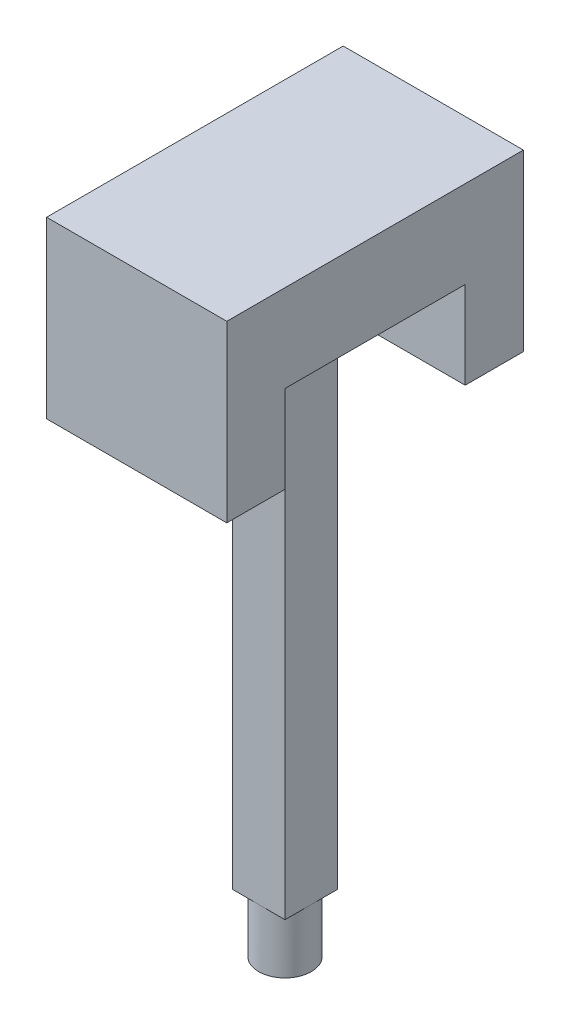
from build123d import *

# Parameters (mm, degrees)
SKETCH1_W           = 1.506666666
SKETCH1_H           = 1.506666666
BOSS_EXTRUDE1_DEPTH = 15
SKETCH2_R           = 0.753333333
BOSS_EXTRUDE2_DEPTH = 1.666666667
SKETCH3_W           = 5.16
SKETCH3_H           = 8.493333334
BOSS_EXTRUDE3_DEPTH = 2.5
SKETCH3_3_W         = 5.16
SKETCH3_3_H         = 1.666666667
BOSS_EXTRUDE4_DEPTH = 2.5


with BuildPart() as part:
    # Sketch1 → Boss-Extrude1 (new body)
    with BuildSketch(Plane(origin=(0, 0, 0), x_dir=(1, 0, 0), z_dir=(0, 1, 0))):
        Rectangle(SKETCH1_W, SKETCH1_H)
    extrude(amount=BOSS_EXTRUDE1_DEPTH)

    # Sketch2 → Boss-Extrude2 (add)
    with BuildSketch(Plane.XZ):
        Circle(SKETCH2_R)
    extrude(amount=BOSS_EXTRUDE2_DEPTH)

    # Sketch3 → Boss-Extrude3 (add)
    with BuildSketch(Plane(origin=(0, 15, 0), x_dir=(1, 0, 0), z_dir=(0, 1, 0))):
        Rectangle(SKETCH3_W, SKETCH3_H)
    extrude(amount=BOSS_EXTRUDE3_DEPTH)

    # Sketch3<3> → Boss-Extrude4 (add)
    with BuildSketch(Plane(origin=(0, 15, 0), x_dir=(1, 0, 0), z_dir=(0, 1, 0))):
        with Locations((0, 3.413333334)):
            Rectangle(SKETCH3_3_W, SKETCH3_3_H)
        with Locations((0, -3.413333334)):
            Rectangle(SKETCH3_3_W, SKETCH3_3_H)
    extrude(amount=-BOSS_EXTRUDE4_DEPTH)


solid = part.part
